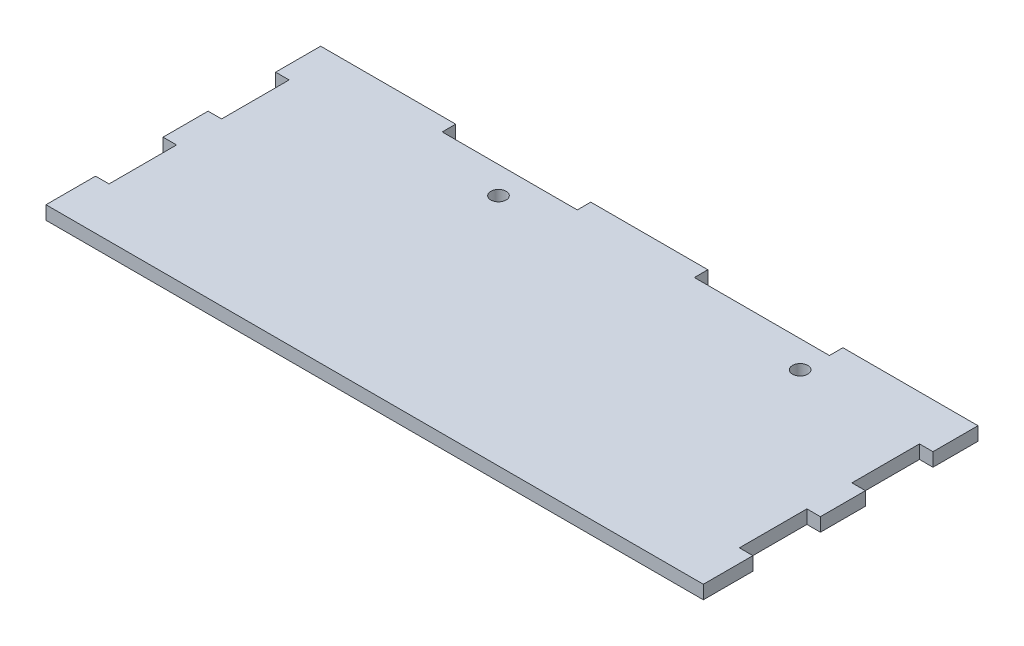
from build123d import *

# Parameters (mm, degrees)
SKETCH1_W           = 146
SKETCH1_H           = 61
BOSS_EXTRUDE1_DEPTH = 3
SKETCH2_R           = 1.7
SKETCH2_W           = 3
SKETCH2_H           = 15
SKETCH2_W_2         = 30
SKETCH2_H_2         = 3
CUT_EXTRUDE1_DEPTH  = 10


with BuildPart() as part:
    # Sketch1 → Boss-Extrude1 (new body)
    with BuildSketch(Plane(origin=(0, 0, 0), x_dir=(1, 0, 0), z_dir=(0, 1, 0))):
        Rectangle(SKETCH1_W, SKETCH1_H)
    extrude(amount=BOSS_EXTRUDE1_DEPTH)

    # Sketch2 → Cut-Extrude1 (cut)
    with BuildSketch(Plane(origin=(0, 3, 0), x_dir=(1, 0, 0), z_dir=(0, 1, 0))):
        with Locations(Location((-24.5, 21.5, 0), (0, 0, 270))):
            Circle(SKETCH2_R)
        with Locations(Location((42.5, 21.5, 0), (0, 0, 270))):
            Circle(SKETCH2_R)
        with Locations((-71.5, 13)):
            Rectangle(SKETCH2_W, SKETCH2_H)
        with Locations((-71.5, -12)):
            Rectangle(SKETCH2_W, SKETCH2_H)
        with Locations((71.5, 13)):
            Rectangle(SKETCH2_W, SKETCH2_H)
        with Locations((71.5, -12)):
            Rectangle(SKETCH2_W, SKETCH2_H)
        with Locations((-28, 29)):
            Rectangle(SKETCH2_W_2, SKETCH2_H_2)
        with Locations((28, 29)):
            Rectangle(SKETCH2_W_2, SKETCH2_H_2)
    extrude(amount=-CUT_EXTRUDE1_DEPTH, mode=Mode.SUBTRACT)


solid = part.part
